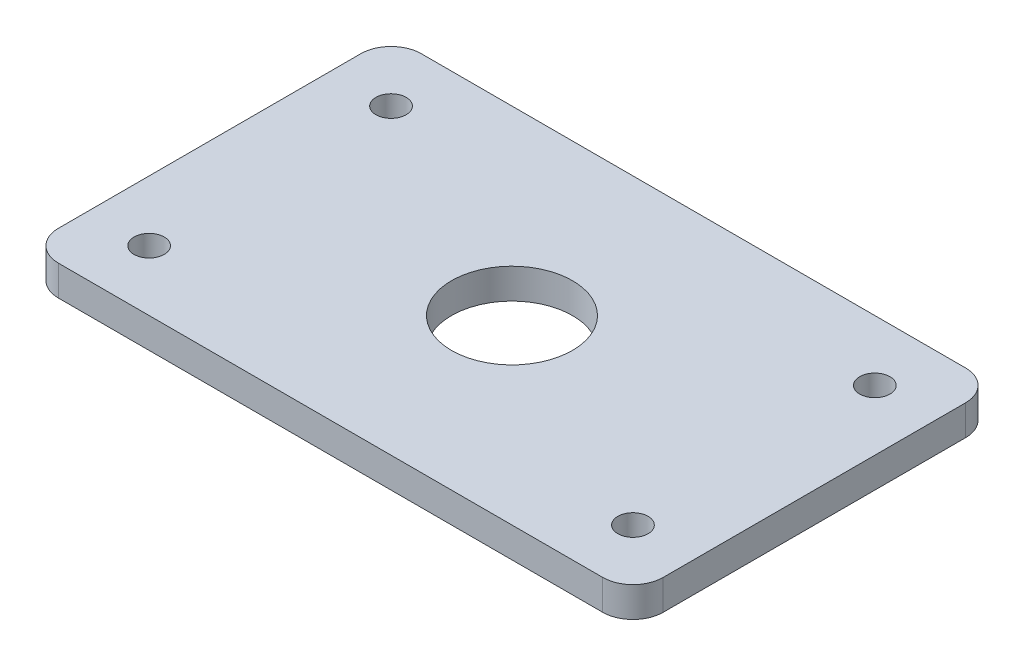
from build123d import *

# Parameters (mm, degrees)
SKETCH1_W            = 127
SKETCH1_H            = 76.2
PLATE_DEPTH          = 6.35
SKETCH2_R            = 3.175
CUT_EXTRUDE1_DEPTH   = 75.324844433
LPATTERN1_COUNT      = 2
LPATTERN1_PITCH      = 101.6
LPATTERN1_COUNT_DIR2 = 2
LPATTERN1_PITCH_DIR2 = 50.8
SKETCH4_R            = 12.7
CUT_EXTRUDE2_DEPTH   = 75.324844433
FILLET1_R            = 6.35


with BuildPart() as part:
    # Sketch1 → Plate (new body)
    with BuildSketch(Plane(origin=(0, 0, 0), x_dir=(1, 0, 0), z_dir=(0, 1, 0))):
        Rectangle(SKETCH1_W, SKETCH1_H)
    extrude(amount=PLATE_DEPTH)

    # Sketch2 → Cut-Extrude1 (cut, through all)
    with BuildSketch(Plane(origin=(0, 6.35, 0), x_dir=(1, 0, 0), z_dir=(0, 1, 0))):
        with Locations(Location((50.8, 25.4, 0), (0, 0, 270))):
            Circle(SKETCH2_R)
    cut_extrude1 = extrude(amount=-CUT_EXTRUDE1_DEPTH, mode=Mode.SUBTRACT)

    # LPattern1: Cut-Extrude1 2 × 2
    with Locations(*[(-i * LPATTERN1_PITCH, 0, j * LPATTERN1_PITCH_DIR2) for i in range(LPATTERN1_COUNT) for j in range(LPATTERN1_COUNT_DIR2) if (i, j) != (0, 0)]):
        add(cut_extrude1, mode=Mode.SUBTRACT)

    # Sketch4 → Cut-Extrude2 (cut, through all)
    with BuildSketch(Plane(origin=(0, 6.35, 0), x_dir=(1, 0, 0), z_dir=(0, 1, 0))):
        with Locations(Location((0, 0, 0), (0, 0, 270))):
            Circle(SKETCH4_R)
    extrude(amount=-CUT_EXTRUDE2_DEPTH, mode=Mode.SUBTRACT)

    # Fillet1
    fillet1_edges = [part.edges().sort_by_distance(p)[0] for p in [
        (-63.5, 3.175, -38.1),
        (63.5, 3.175, -38.1),
        (63.5, 3.175, 38.1),
        (-63.5, 3.175, 38.1),
    ]]
    fillet(fillet1_edges, radius=FILLET1_R)


solid = part.part
